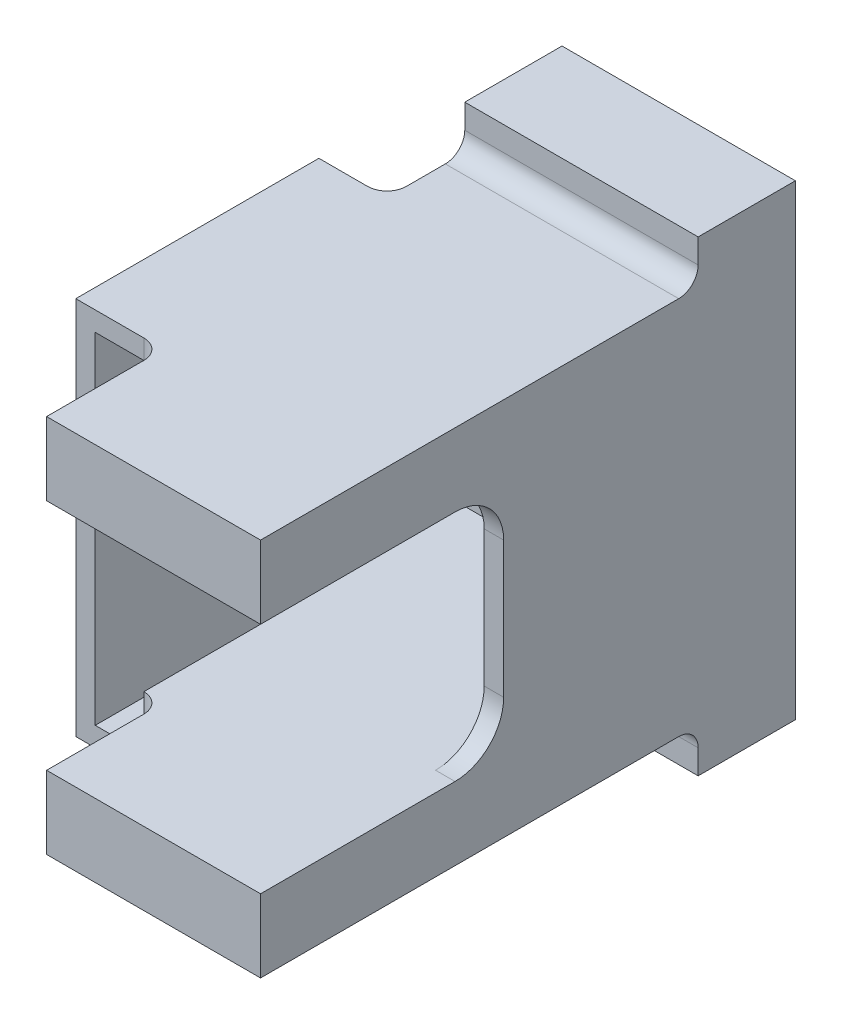
from build123d import *

# Parameters (mm, degrees)
SKETCH_2_W          = 24
SKETCH_2_H          = 28
EXTRUDE_1_DEPTH     = 22
SKETCH_3_W          = 20
SKETCH_3_H          = 24
CUT_EXTRUDE_1_DEPTH = 18
SKETCH_4_W          = 16
SKETCH_4_H          = 13
CUT_EXTRUDE_3_DEPTH = 26.768197453
SKETCH_6_W          = 20
SKETCH_6_H          = 24
CUT_EXTRUDE_4_DEPTH = 5
SKETCH_7_W          = 24
SKETCH_7_H          = 2
EXTRUDE_3_DEPTH     = 10
SKETCH_8_W          = 24
SKETCH_8_H          = 2
EXTRUDE_4_DEPTH     = 10
EXTRUDE_5_DEPTH     = 35
SKETCH_10_W         = 22
SKETCH_10_H         = 2
EXTRUDE_6_DEPTH     = 25
FILLET_2_R          = 5
SKETCH_11_W         = 7
SKETCH_11_H         = 10
CUT_EXTRUDE_5_DEPTH = 67.80007485
FILLET_4_R          = 2
SKETCH_12_W         = 20
SKETCH_12_H         = 13.5
EXTRUDE_7_DEPTH     = 8
RIB_1_REACH         = 64.944
SKETCH_14_W         = 22
SKETCH_14_H         = 5.5
EXTRUDE_8_DEPTH     = 45
FILLET_5_R          = 2


with BuildPart() as part:
    # ｽｹｯﾁ2 → ﾎﾞｽ - 押し出し1 (new body)
    with BuildSketch(Plane.XY):
        Rectangle(SKETCH_2_W, SKETCH_2_H)
    extrude(amount=EXTRUDE_1_DEPTH)

    # ｽｹｯﾁ3 → ｶｯﾄ - 押し出し1 (cut)
    with BuildSketch(Plane.XY.offset(22)):
        Rectangle(SKETCH_3_W, SKETCH_3_H)
    extrude(amount=-CUT_EXTRUDE_1_DEPTH, mode=Mode.SUBTRACT)

    # ｽｹｯﾁ4 → ｶｯﾄ - 押し出し3 (cut, through all)
    with BuildSketch(Plane.XY.offset(4)):
        with Locations((-4, 0)):
            Rectangle(SKETCH_4_W, SKETCH_4_H)
    extrude(amount=-CUT_EXTRUDE_3_DEPTH, mode=Mode.SUBTRACT)

    # ｽｹｯﾁ6 → ｶｯﾄ - 押し出し4 (cut)
    with BuildSketch(Plane.ZY.offset(12)):
        with Locations((12, 0)):
            Rectangle(SKETCH_6_W, SKETCH_6_H)
    extrude(amount=-CUT_EXTRUDE_4_DEPTH, mode=Mode.SUBTRACT)

    # ｽｹｯﾁ7 → ﾎﾞｽ - 押し出し3 (add)
    with BuildSketch(Plane.XZ.offset(14)):
        with Locations((0, 1)):
            Rectangle(SKETCH_7_W, SKETCH_7_H)
    extrude(amount=EXTRUDE_3_DEPTH)

    # ｽｹｯﾁ8 → ﾎﾞｽ - 押し出し4 (add)
    with BuildSketch(Plane(origin=(0, 14, 0), x_dir=(1, 0, 0), z_dir=(0, 1, 0))):
        with Locations((0, -1)):
            Rectangle(SKETCH_8_W, SKETCH_8_H)
    extrude(amount=EXTRUDE_4_DEPTH)

    # ｽｹｯﾁ9 → ﾎﾞｽ - 押し出し5 (add)
    with BuildSketch(Plane(origin=(0, 0, 0), x_dir=(-1, 0, 0), z_dir=(0, 0, -1))):
        Polygon((12, 17.5), (17, 17.5), (17, -17.5), (12, -17.5), (12, -12), (10, -12), (10, -19.5), (19, -19.5), (19, 19.5), (10, 19.5), (10, 12), (12, 12), align=None)
    extrude(amount=-EXTRUDE_5_DEPTH)

    # ｽｹｯﾁ10 → ﾎﾞｽ - 押し出し6 (add)
    with BuildSketch(Plane.XY.offset(22)):
        with Locations((1, 13)):
            Rectangle(SKETCH_10_W, SKETCH_10_H)
        with Locations((1, -13)):
            Rectangle(SKETCH_10_W, SKETCH_10_H)
    extrude(amount=EXTRUDE_6_DEPTH)

    # ﾌｨﾚｯﾄ2
    fillet_2_edges = [part.edges().sort_by_distance(p)[0] for p in [
        (11, 12, 22),
        (11, -12, 22),
    ]]
    fillet(fillet_2_edges, radius=FILLET_2_R)

    # ｽｹｯﾁ11 → ｶｯﾄ - 押し出し5 (cut, through all)
    with BuildSketch(Plane(origin=(0, 19.5, 0), x_dir=(1, 0, 0), z_dir=(0, 1, 0))):
        with Locations((-15.5, -5)):
            Rectangle(SKETCH_11_W, SKETCH_11_H)
    extrude(amount=-CUT_EXTRUDE_5_DEPTH, mode=Mode.SUBTRACT)

    # ﾌｨﾚｯﾄ4
    fillet_4_edges = [part.edges().sort_by_distance(p)[0] for p in [
        (-12, -18.5, 10),
        (-12, 18.5, 10),
    ]]
    fillet(fillet_4_edges, radius=FILLET_4_R)

    # ｽｹｯﾁ12 → ﾎﾞｽ - 押し出し7 (add)
    with BuildSketch(Plane(origin=(0, 0, 0), x_dir=(-1, 0, 0), z_dir=(0, 0, -1))):
        Polygon((-12, 24), (12, 24), (12, 6.5), (-4, 6.5), (-4, -6.5), (12, -6.5), (12, -24), (-12, -24), (-12, -6.5), (-12, 6.5), align=None)
        with Locations((0, -15.25)):
            Rectangle(SKETCH_12_W, SKETCH_12_H, mode=Mode.SUBTRACT)
        with Locations((0, 15.25)):
            Rectangle(SKETCH_12_W, SKETCH_12_H, mode=Mode.SUBTRACT)
    extrude(amount=EXTRUDE_7_DEPTH)

    # ｽｹｯﾁ13 walls → ﾘﾌﾞ1 (add, up to next)
    with BuildSketch(Plane(origin=(0, 0, -8), x_dir=(-1, 0, 0), z_dir=(0, 0, -1)), mode=Mode.PRIVATE) as rib_1_sk1:
        Polygon((-63.559720526, 56.946318504), (62.440774816, -28.104015852), (63.559720526, -26.446318504), (-62.440774816, 58.604015852), align=None)
    rib_1_tool1 = extrude(rib_1_sk1.sketch, amount=-RIB_1_REACH, mode=Mode.PRIVATE) - part.part
    # ｽｹｯﾁ13 walls → ﾘﾌﾞ1 (add, up to next)
    with BuildSketch(Plane(origin=(0, 0, -8), x_dir=(-1, 0, 0), z_dir=(0, 0, -1)), mode=Mode.PRIVATE) as rib_1_sk2:
        Polygon((-62.440774816, -28.104015852), (63.559720526, 56.946318504), (62.440774816, 58.604015852), (-63.559720526, -26.446318504), align=None)
    rib_1_tool2 = extrude(rib_1_sk2.sketch, amount=-RIB_1_REACH, mode=Mode.PRIVATE) - part.part
    # ｽｹｯﾁ13 walls → ﾘﾌﾞ1 (add, up to next)
    with BuildSketch(Plane(origin=(0, 0, -8), x_dir=(-1, 0, 0), z_dir=(0, 0, -1)), mode=Mode.PRIVATE) as rib_1_sk3:
        Polygon((-63.559720526, 26.446318504), (62.440774816, -58.604015852), (63.559720526, -56.946318504), (-62.440774816, 28.104015852), align=None)
    rib_1_tool3 = extrude(rib_1_sk3.sketch, amount=-RIB_1_REACH, mode=Mode.PRIVATE) - part.part
    # ｽｹｯﾁ13 walls → ﾘﾌﾞ1 (add, up to next)
    with BuildSketch(Plane(origin=(0, 0, -8), x_dir=(-1, 0, 0), z_dir=(0, 0, -1)), mode=Mode.PRIVATE) as rib_1_sk4:
        Polygon((-62.440774816, -58.604015852), (63.559720526, 26.446318504), (62.440774816, 28.104015852), (-63.559720526, -56.946318504), align=None)
    rib_1_tool4 = extrude(rib_1_sk4.sketch, amount=-RIB_1_REACH, mode=Mode.PRIVATE) - part.part
    add(rib_1_tool1.solids().sort_by_distance((0, 15.25, -8))[0])
    add(rib_1_tool2.solids().sort_by_distance((0, 15.25, -8))[0])
    add(rib_1_tool3.solids().sort_by_distance((0, -15.25, -8))[0])
    add(rib_1_tool4.solids().sort_by_distance((0, -15.25, -8))[0])

    # ｽｹｯﾁ14 → ﾎﾞｽ - 押し出し8 (add)
    with BuildSketch(Plane.XY.offset(2)):
        with Locations((1, 16.75)):
            Rectangle(SKETCH_14_W, SKETCH_14_H)
        with Locations((1, -16.75)):
            Rectangle(SKETCH_14_W, SKETCH_14_H)
    extrude(amount=EXTRUDE_8_DEPTH)

    # ﾌｨﾚｯﾄ5
    fillet_5_edges = [part.edges().sort_by_distance(p)[0] for p in [
        (0, -19.5, 2),
        (0, 19.5, 2),
        (-10, -15.75, 35),
        (-10, 15.75, 35),
    ]]
    fillet(fillet_5_edges, radius=FILLET_5_R)


solid = part.part
